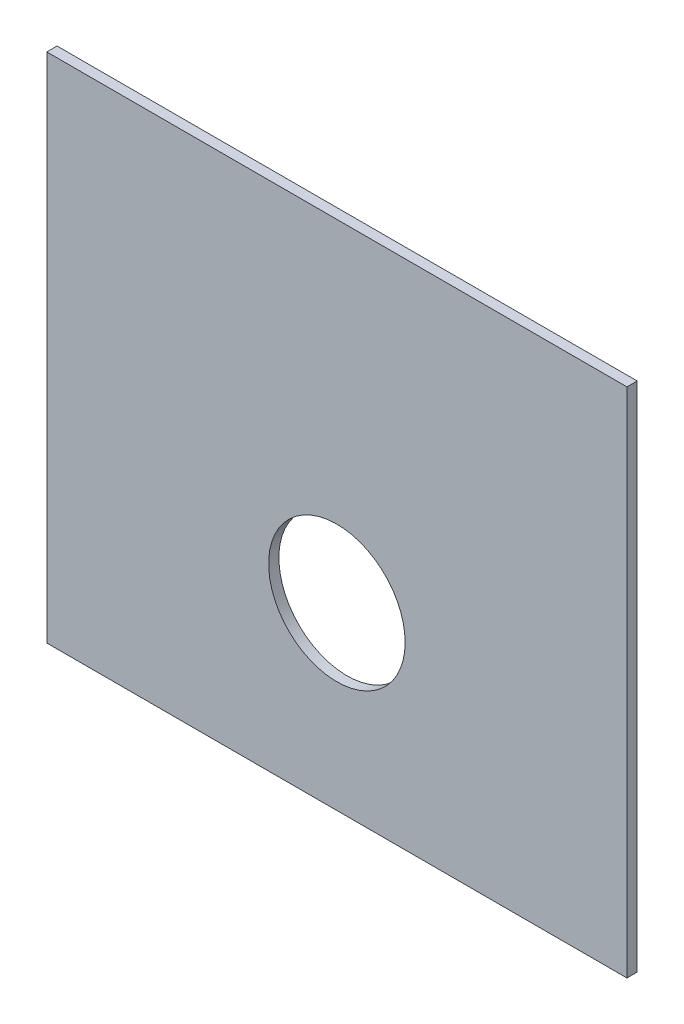
from build123d import *

# Parameters (mm, degrees)
SKETCH_1_W          = 170
SKETCH_1_H          = 150
EXTRUDE_1_DEPTH     = 3
SKETCH_2_R          = 20
CUT_EXTRUDE_1_DEPTH = 227.735528755


with BuildPart() as part:
    # 草圖1 → 填料-伸長1 (new body)
    with BuildSketch(Plane.XY):
        with Locations((85, 75)):
            Rectangle(SKETCH_1_W, SKETCH_1_H)
    extrude(amount=EXTRUDE_1_DEPTH)

    # 草圖2 → 除料-伸長1 (cut, through all)
    with BuildSketch(Plane.XY.offset(3)):
        with Locations((85, 52.664237253)):
            Circle(SKETCH_2_R)
    extrude(amount=-CUT_EXTRUDE_1_DEPTH, mode=Mode.SUBTRACT)


solid = part.part
